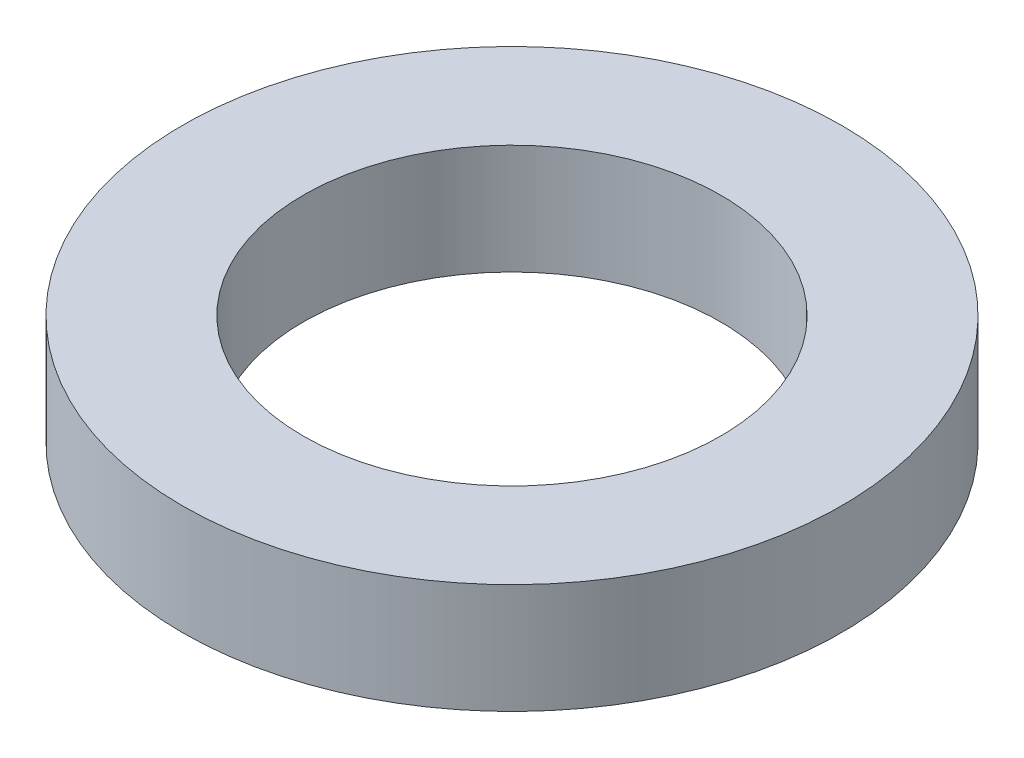
from build123d import *

# Parameters (mm, degrees)
SKETCH2_R           = 3
SKETCH2_R_2         = 1.9
BOSS_EXTRUDE1_DEPTH = 1


with BuildPart() as part:
    # Sketch2 → Boss-Extrude1 (new body)
    with BuildSketch(Plane(origin=(0, 0, 0), x_dir=(1, 0, 0), z_dir=(0, 1, 0))):
        with Locations(Location((0, 0, 0), (0, 0, 270))):
            Circle(SKETCH2_R)
        with Locations(Location((0, 0, 0), (0, 0, 270))):
            Circle(SKETCH2_R_2, mode=Mode.SUBTRACT)
    extrude(amount=BOSS_EXTRUDE1_DEPTH)


solid = part.part
